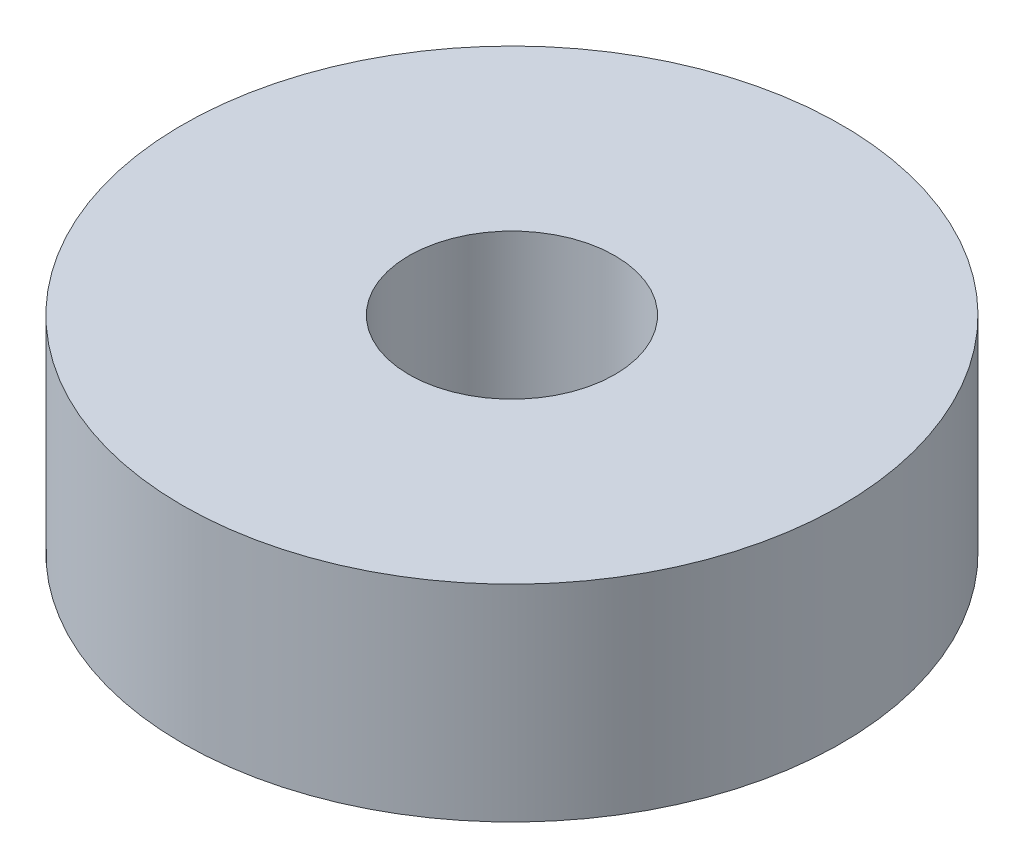
from build123d import *

# Parameters (mm, degrees)
SKETCH1_R           = 8
SKETCH1_R_2         = 2.5
BOSS_EXTRUDE1_DEPTH = 5


with BuildPart() as part:
    # Sketch1 → Boss-Extrude1 (new body)
    with BuildSketch(Plane(origin=(0, 0, 0), x_dir=(1, 0, 0), z_dir=(0, 1, 0))):
        with Locations(Location((0, 0, 0), (0, 0, 270))):
            Circle(SKETCH1_R)
        with Locations(Location((0, 0, 0), (0, 0, 270))):
            Circle(SKETCH1_R_2, mode=Mode.SUBTRACT)
    extrude(amount=BOSS_EXTRUDE1_DEPTH)


solid = part.part
